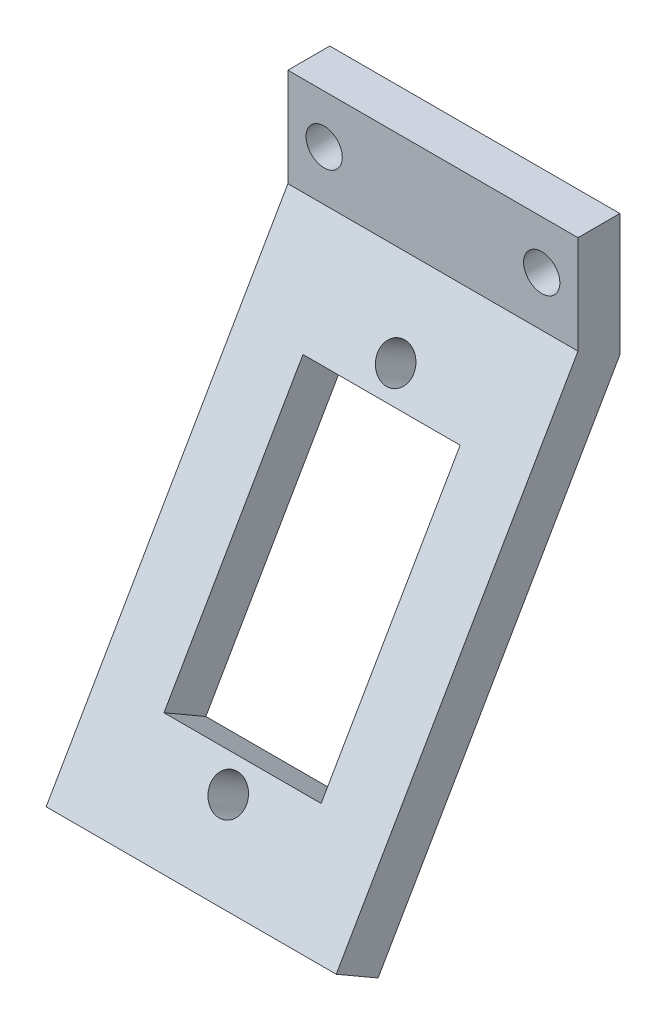
from build123d import *

# Parameters (mm, degrees)
SKETCH_11_W         = 24
SKETCH_11_H         = 40
SKETCH_11_W_2       = 13
SKETCH_11_H_2       = 23
EXTRUDE_1_DEPTH     = 4
SKETCH_12_R         = 1.5
CUT_EXTRUDE_1_DEPTH = 4
EXTRUDE_2_REACH     = 99.098
SKETCH_13_W         = 24
SKETCH_13_H         = 3.464101616
SKETCH_14_R         = 1.5
CUT_EXTRUDE_2_DEPTH = 4


with BuildPart() as part:
    # 草图11 → 凸台-拉伸1 (new body)
    with BuildSketch(Plane(origin=(0, 43, 74.478184725), x_dir=(-1, 0, 0), z_dir=(0, 0.500000000000001, 0.866025403784438))):
        with Locations((-0.009864086, -5.25)):
            Rectangle(SKETCH_11_W, SKETCH_11_H)
        with Locations((-0.009864086, -5.25)):
            Rectangle(SKETCH_11_W_2, SKETCH_11_H_2, mode=Mode.SUBTRACT)
    extrude(amount=EXTRUDE_1_DEPTH)

    # 草图12 → 切除-拉伸1 (cut)
    with BuildSketch(Plane(origin=(0, 43, 74.478184725), x_dir=(-1, 0, 0), z_dir=(0, -0.5000000000000009, -0.8660254037844383))):
        with Locations((0, 19.1)):
            Circle(SKETCH_12_R)
        with Locations((0, -8.6)):
            Circle(SKETCH_12_R)
    extrude(amount=-CUT_EXTRUDE_1_DEPTH, mode=Mode.SUBTRACT)

    # 凸台-拉伸2: up to this plane
    extrude_2_end = Plane(origin=(12.009864086, 66.867141446, 65.317286341), z_dir=(0, -0.866025403784438, 0.500000000000001))
    # 草图13 → 凸台-拉伸2 (add, up to the surface)
    with BuildSketch(Plane(origin=(0, 75, 0), x_dir=(1, 0, 0), z_dir=(0, 1, 0)), mode=Mode.PRIVATE) as extrude_2_sk1:
        with Locations((0.009864086, -63.585235533)):
            Rectangle(SKETCH_13_W, SKETCH_13_H)
    extrude_2_tool1 = split(extrude(extrude_2_sk1.sketch, amount=-EXTRUDE_2_REACH, mode=Mode.PRIVATE), bisect_by=extrude_2_end, keep=Keep.BOTH, mode=Mode.PRIVATE)
    add(extrude_2_tool1.solids().sort_by_distance((0.009864, 75, 63.585236))[0])

    # 草图14 → 切除-拉伸2 (cut)
    with BuildSketch(Plane(origin=(0, 0, 61.853184725), x_dir=(-1, 0, 0), z_dir=(0, 0, -1))):
        with Locations((8.990135914, 71)):
            Circle(SKETCH_14_R)
        with Locations((-9.009864086, 71)):
            Circle(SKETCH_14_R)
    extrude(amount=-CUT_EXTRUDE_2_DEPTH, mode=Mode.SUBTRACT)


solid = part.part
